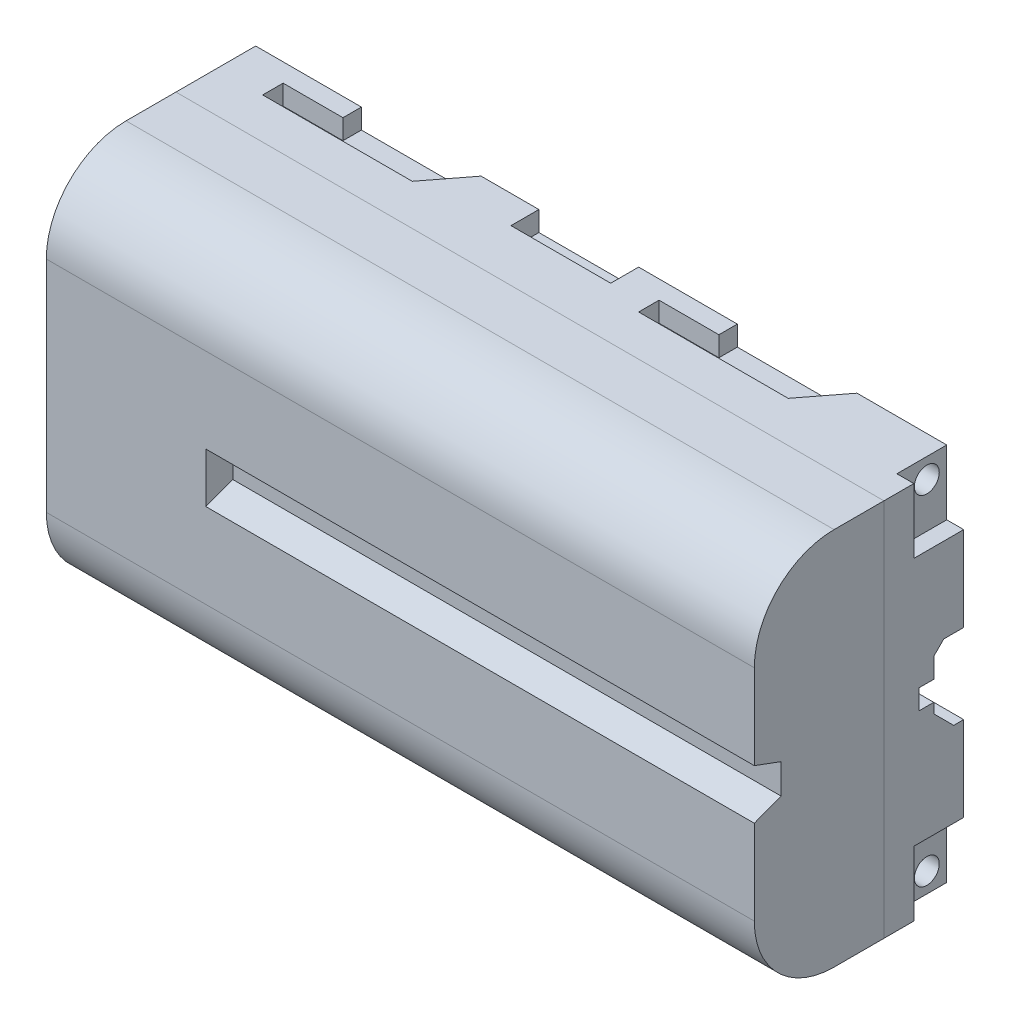
from build123d import *

# Parameters (mm, degrees)
SKETCH_1_W                      = 71
SKETCH_1_H                      = 38
EXTRUDE_1_DEPTH                 = 8
SKETCH_2_W                      = 5
SKETCH_2_H                      = 6.5
CUT_EXTRUDE_1_DEPTH             = 1.7
SKETCH_3_W                      = 10
SKETCH_3_H                      = 2.8
CUT_EXTRUDE_2_DEPTH             = 2
SKETCH_4_W                      = 9.6
SKETCH_4_H                      = 4.4
SKETCH_4_W_2                    = 10
CUT_EXTRUDE_3_DEPTH             = 3
SKETCH_5_W                      = 8.2
SKETCH_5_H                      = 8
CUT_EXTRUDE_4_DEPTH             = 2.4
CUT_EXTRUDE_5_DEPTH             = 7.5
CUT_EXTRUDE_6_DEPTH             = 13.4
SKETCH_9_W                      = 5
SKETCH_9_H                      = 4
CUT_EXTRUDE_7_DEPTH             = 1.6
CUT_EXTRUDE_8_REACH             = 75.932
CUT_EXTRUDE_8_DIRECTION_2_REACH = 75.932
SKETCH_12_R                     = 1.25
CUT_EXTRUDE_9_DEPTH             = 7
SKETCH_13_W                     = 71
SKETCH_13_H                     = 38
EXTRUDE_2_DEPTH                 = 13
FILLET_1_R                      = 8
CUT_EXTRUDE_10_DEPTH            = 55


with BuildPart() as part:
    # Эскиз1 → Бобышка-Вытянуть1 (new body)
    with BuildSketch(Plane.XY):
        with Locations((35.5, 19)):
            Rectangle(SKETCH_1_W, SKETCH_1_H)
    extrude(amount=EXTRUDE_1_DEPTH)

    # Эскиз2 → Вырез-Вытянуть1 (cut)
    with BuildSketch(Plane(origin=(71, 0, 0), x_dir=(0, 0, -1), z_dir=(1, 0, 0))):
        with Locations((-2.5, 3.25)):
            Rectangle(SKETCH_2_W, SKETCH_2_H)
        with Locations((-2.5, 34.75)):
            Rectangle(SKETCH_2_W, SKETCH_2_H)
    extrude(amount=-CUT_EXTRUDE_1_DEPTH, mode=Mode.SUBTRACT)

    # Эскиз3 → Вырез-Вытянуть2 (cut)
    with BuildSketch(Plane.XZ):
        Polygon((60.3, 0), (57.3, 3.9), (42.3, 3.9), (42.3, 1.85), (48.3, 1.85), (48.3, 0), align=None)
        with Locations((33.4, 1.4)):
            Rectangle(SKETCH_3_W, SKETCH_3_H)
        Polygon((22.6, 0), (19.6, 3.9), (4.6, 3.9), (4.6, 1.85), (10.6, 1.85), (10.6, 0), align=None)
    cut_extrude_2 = extrude(amount=-CUT_EXTRUDE_2_DEPTH, mode=Mode.SUBTRACT)

    # Зеркальное отражение1: Вырез-Вытянуть2 across plane
    add(cut_extrude_2.mirror(Plane(origin=(0, 19, 0), x_dir=(0, 0, 1), z_dir=(0, -1, 0))), mode=Mode.SUBTRACT)

    # Эскиз4 → Вырез-Вытянуть3 (cut)
    with BuildSketch(Plane(origin=(0, 0, 0), x_dir=(-1, 0, 0), z_dir=(0, 0, -1))):
        with Locations((-4.8, 19)):
            Rectangle(SKETCH_4_W, SKETCH_4_H)
        with Locations((-33.6, 19)):
            Rectangle(SKETCH_4_W_2, SKETCH_4_H)
    extrude(amount=-CUT_EXTRUDE_3_DEPTH, mode=Mode.SUBTRACT)

    # Эскиз5 → Вырез-Вытянуть4 (cut)
    with BuildSketch(Plane(origin=(0, 0, 0), x_dir=(-1, 0, 0), z_dir=(0, 0, -1))):
        with Locations((-46, 19)):
            Rectangle(SKETCH_5_W, SKETCH_5_H)
    extrude(amount=-CUT_EXTRUDE_4_DEPTH, mode=Mode.SUBTRACT)

    # Эскиз7 → Вырез-Вытянуть5 (cut)
    with BuildSketch(Plane(origin=(71, 0, 0), x_dir=(0, 0, -1), z_dir=(1, 0, 0))):
        Polygon((-3, 18), (-3, 17), (-1, 15), (0, 15), (0, 23), (-2, 23), (-3, 22), (-3, 20), (-4.5, 20), (-4.5, 18), align=None)
    extrude(amount=-CUT_EXTRUDE_5_DEPTH, mode=Mode.SUBTRACT)

    # Эскиз8 → Вырез-Вытянуть6 (cut)
    with BuildSketch(Plane(origin=(63.5, 0, 0), x_dir=(0, 0, -1), z_dir=(1, 0, 0))):
        Polygon((0, 23), (-2, 23), (-3, 22), (-3, 20), (0, 20), align=None)
    extrude(amount=-CUT_EXTRUDE_6_DEPTH, mode=Mode.SUBTRACT)

    # Эскиз9 → Вырез-Вытянуть7 (cut)
    with BuildSketch(Plane(origin=(0, 0, 0), x_dir=(-1, 0, 0), z_dir=(0, 0, -1))):
        with Locations((-61, 18)):
            Rectangle(SKETCH_9_W, SKETCH_9_H)
    extrude(amount=-CUT_EXTRUDE_7_DEPTH, mode=Mode.SUBTRACT)

    # Вырез-Вытянуть8: up to this face of the body (flat: up to its plane)
    cut_extrude_8_end = Plane(part.part.faces().sort_by_distance((33.6, 21.2, 1.5))[0])
    # Эскиз11 → Вырез-Вытянуть8 (cut, up to the picked face)
    with BuildSketch(Plane(origin=(0, 19, 0), x_dir=(-1, 0, 0), z_dir=(0, -1, 0)), mode=Mode.PRIVATE) as cut_extrude_8_sk1:
        Polygon((-20.6, 0), (-11.6, 0), (-17.1, -3), (-20.6, -3), align=None)
    cut_extrude_8_tool1 = split(extrude(cut_extrude_8_sk1.sketch, amount=-CUT_EXTRUDE_8_REACH, mode=Mode.PRIVATE), bisect_by=cut_extrude_8_end, keep=Keep.BOTH, mode=Mode.PRIVATE)
    add(cut_extrude_8_tool1.solids().sort_by(Axis((17.273333, 19, 1.28), (0, 1, 0)))[0], mode=Mode.SUBTRACT)

    # Вырез-Вытянуть8 direction 2: up to this face of the body (flat: up to its plane)
    cut_extrude_8_direction_2_end = Plane(part.part.faces().sort_by_distance((33.6, 16.8, 1.5))[0])
    # Эскиз11 → Вырез-Вытянуть8 direction 2 (cut, up to the picked face)
    with BuildSketch(Plane(origin=(0, 19, 0), x_dir=(-1, 0, 0), z_dir=(0, -1, 0)), mode=Mode.PRIVATE) as cut_extrude_8_direction_2_sk1:
        Polygon((-20.6, 0), (-11.6, 0), (-17.1, -3), (-20.6, -3), align=None)
    cut_extrude_8_direction_2_tool1 = split(extrude(cut_extrude_8_direction_2_sk1.sketch, amount=CUT_EXTRUDE_8_DIRECTION_2_REACH, mode=Mode.PRIVATE), bisect_by=cut_extrude_8_direction_2_end, keep=Keep.BOTH, mode=Mode.PRIVATE)
    add(cut_extrude_8_direction_2_tool1.solids().sort_by(Axis((17.273333, 19, 1.28), (0, -1, 0)))[0], mode=Mode.SUBTRACT)

    # Эскиз12 → Вырез-Вытянуть9 (cut)
    with BuildSketch(Plane(origin=(69.3, 0, 0), x_dir=(0, 0, -1), z_dir=(1, 0, 0))):
        with Locations((-2, 36)):
            Circle(SKETCH_12_R)
        with Locations(Location((-2, 2, 0), (0, 0, 180))):
            Circle(SKETCH_12_R)
    extrude(amount=-CUT_EXTRUDE_9_DEPTH, mode=Mode.SUBTRACT)


with BuildPart() as body_2:
    # Эскиз13 → Бобышка-Вытянуть2 (new body)
    with BuildSketch(Plane.XY.offset(8)):
        with Locations((35.5, 19)):
            Rectangle(SKETCH_13_W, SKETCH_13_H)
    extrude(amount=EXTRUDE_2_DEPTH)

    # Скругление1
    fillet_1_edges = [body_2.edges().sort_by_distance(p)[0] for p in [
        (35.5, 0, 21),
        (35.5, 38, 21),
    ]]
    fillet(fillet_1_edges, radius=FILLET_1_R)

    # Эскиз14 → Вырез-Вытянуть10 (cut)
    with BuildSketch(Plane(origin=(71, 0, 0), x_dir=(0, 0, -1), z_dir=(1, 0, 0))):
        Polygon((-21, 16.5), (-21, 21.5), (-18.3, 20.5), (-18.3, 17.5), align=None)
    extrude(amount=-CUT_EXTRUDE_10_DEPTH, mode=Mode.SUBTRACT)


solid = Compound([part.part, body_2.part])
